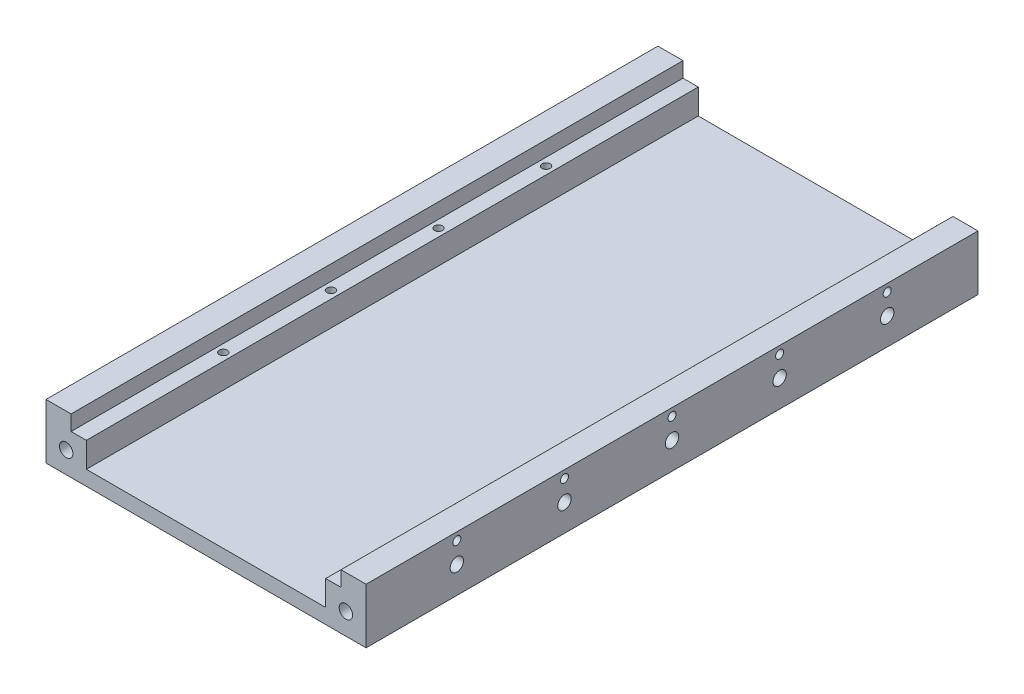
from build123d import *

# Parameters (mm, degrees)
BOSS_EXTRUDE1_DEPTH             = 227.5
TAP_DRILL_FOR_M5X0_8_TAP1_D     = 5
TAP_DRILL_FOR_M5X0_8_TAP1_DEPTH = 10
TAP_DRILL_FOR_M5X0_8_TAP2_D     = 5
TAP_DRILL_FOR_M5X0_8_TAP2_DEPTH = 10
TAP_DRILL_FOR_M5X0_8_TAP3_D     = 5
TAP_DRILL_FOR_M5X0_8_TAP3_DEPTH = 10
TAP_DRILL_FOR_M5X0_8_TAP4_D     = 5
TAP_DRILL_FOR_M5X0_8_TAP4_DEPTH = 10
SKETCH11_R                      = 1.5
CUT_EXTRUDE1_DEPTH              = 29
SKETCH13_R                      = 1.5
CUT_EXTRUDE2_DEPTH              = 29


with BuildPart() as part:
    # Sketch1 → Boss-Extrude1 (new body)
    with BuildSketch(Plane.XY):
        Polygon((44.5, 5.5), (-44.5, 5.5), (-44.5, 14.835), (-50.17, 14.835), (-50.17, 20.5), (-59.5, 20.5), (-59.5, 0), (59.5, 0), (59.5, 20.5), (50.17, 20.5), (50.17, 14.835), (44.5, 14.835), align=None)
    extrude(amount=BOSS_EXTRUDE1_DEPTH)

    # Tap Drill for M5x0.8 Tap1
    with Locations(Plane.XY.offset(227.5)):
        with Locations((52, 8), (-52, 8)):
            Hole(TAP_DRILL_FOR_M5X0_8_TAP1_D / 2, depth=TAP_DRILL_FOR_M5X0_8_TAP1_DEPTH)

    # Tap Drill for M5x0.8 Tap2
    with Locations(Plane(origin=(0, 0, 0), x_dir=(-1, 0, 0), z_dir=(0, 0, -1))):
        with Locations((52, 8), (-52, 8)):
            Hole(TAP_DRILL_FOR_M5X0_8_TAP2_D / 2, depth=TAP_DRILL_FOR_M5X0_8_TAP2_DEPTH)

    # Tap Drill for M5x0.8 Tap3
    with Locations(Plane(origin=(59.5, 0, 0), x_dir=(0, 0, -1), z_dir=(1, 0, 0))):
        with Locations((-193.75, 10), (-153.75, 10), (-113.75, 10), (-73.75, 10), (-33.75, 10)):
            Hole(TAP_DRILL_FOR_M5X0_8_TAP3_D / 2, depth=TAP_DRILL_FOR_M5X0_8_TAP3_DEPTH)

    # Tap Drill for M5x0.8 Tap4
    with Locations(Plane.ZY.offset(59.5)):
        with Locations((193.75, 10), (153.75, 10), (113.75, 10), (73.75, 10), (33.75, 10)):
            Hole(TAP_DRILL_FOR_M5X0_8_TAP4_D / 2, depth=TAP_DRILL_FOR_M5X0_8_TAP4_DEPTH)

    # Sketch11 → Cut-Extrude1 (cut)
    with BuildSketch(Plane.XZ):
        with Locations((-47.33, 173.75)):
            Circle(SKETCH11_R)
        with Locations((-47.33, 133.75)):
            Circle(SKETCH11_R)
        with Locations((-47.33, 93.75)):
            Circle(SKETCH11_R)
        with Locations((-47.33, 53.75)):
            Circle(SKETCH11_R)
        with Locations(Location((47.33, 53.75, 0), (0, 0, 270))):
            Circle(SKETCH11_R)
        with Locations(Location((47.33, 93.75, 0), (0, 0, 270))):
            Circle(SKETCH11_R)
        with Locations(Location((47.33, 133.75, 0), (0, 0, 270))):
            Circle(SKETCH11_R)
        with Locations(Location((47.33, 173.75, 0), (0, 0, 270))):
            Circle(SKETCH11_R)
    extrude(amount=-CUT_EXTRUDE1_DEPTH, mode=Mode.SUBTRACT)

    # Sketch13 → Cut-Extrude2 (cut)
    with BuildSketch(Plane.ZY.offset(-50.17)):
        with Locations((193.75, 17.6675)):
            Circle(SKETCH13_R)
        with Locations((153.75, 17.6675)):
            Circle(SKETCH13_R)
        with Locations((113.75, 17.6675)):
            Circle(SKETCH13_R)
        with Locations((73.75, 17.6675)):
            Circle(SKETCH13_R)
        with Locations((33.75, 17.6675)):
            Circle(SKETCH13_R)
    extrude(amount=-CUT_EXTRUDE2_DEPTH, mode=Mode.SUBTRACT)


solid = part.part
